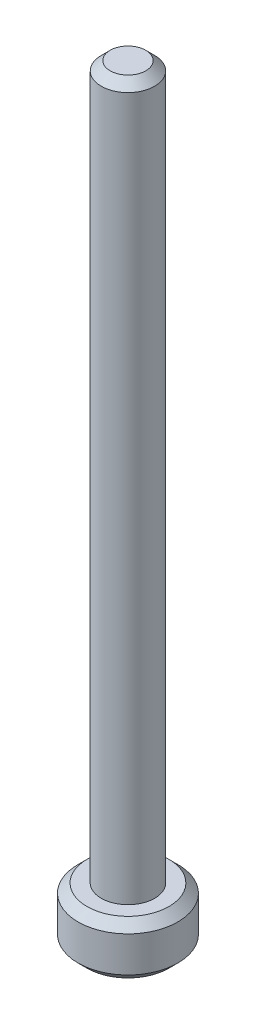
from build123d import *

# Parameters (mm, degrees)
SKETCH1_R           = 2.8
BOSS_EXTRUDE1_DEPTH = 1.5
SKETCH2_R           = 1.5
BOSS_EXTRUDE2_DEPTH = 40
CHAMFER1_SIZE       = 0.5
CHAMFER2_SIZE       = 0.5


with BuildPart() as part:
    # Sketch1 → Boss-Extrude1 (new, symmetric)
    with BuildSketch(Plane(origin=(0, 0, 0), x_dir=(1, 0, 0), z_dir=(0, 1, 0))):
        with Locations(Location((0, 0, 0), (0, 0, 270))):
            Circle(SKETCH1_R)
    extrude(amount=BOSS_EXTRUDE1_DEPTH, both=True)

    # Sketch2 → Boss-Extrude2 (add)
    with BuildSketch(Plane(origin=(0, 1.5, 0), x_dir=(1, 0, 0), z_dir=(0, 1, 0))):
        with Locations(Location((0, 0, 0), (0, 0, 270))):
            Circle(SKETCH2_R)
    extrude(amount=BOSS_EXTRUDE2_DEPTH)

    # Chamfer1
    chamfer1_edges = [part.edges().sort_by_distance(p)[0] for p in [
        (0, 41.5, -1.5),
    ]]
    chamfer(chamfer1_edges, length=CHAMFER1_SIZE)

    # Chamfer2
    chamfer2_edges = [part.edges().sort_by_distance(p)[0] for p in [
        (0, -1.5, -2.8),
        (0, 1.5, -2.8),
    ]]
    chamfer(chamfer2_edges, length=CHAMFER2_SIZE)


solid = part.part
